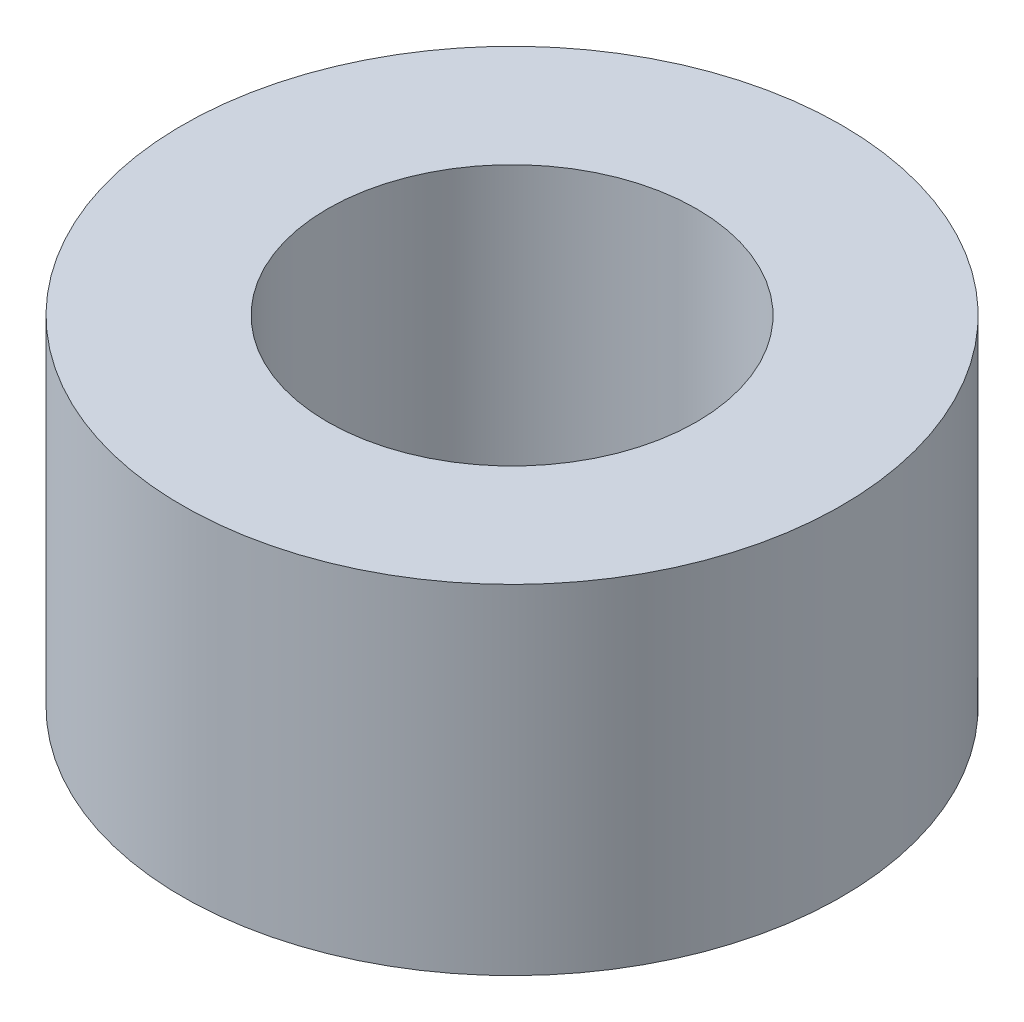
from build123d import *

# Parameters (mm, degrees)
SKETCH1_R           = 3.175
SKETCH1_R_2         = 1.778
BOSS_EXTRUDE1_DEPTH = 3.2639


with BuildPart() as part:
    # Sketch1 → Boss-Extrude1 (new body)
    with BuildSketch(Plane(origin=(0, 0, 0), x_dir=(1, 0, 0), z_dir=(0, 1, 0))):
        with Locations(Location((0, 0, 0), (0, 0, 90))):
            Circle(SKETCH1_R)
        with Locations(Location((0, 0, 0), (0, 0, 90))):
            Circle(SKETCH1_R_2, mode=Mode.SUBTRACT)
    extrude(amount=BOSS_EXTRUDE1_DEPTH)


solid = part.part
